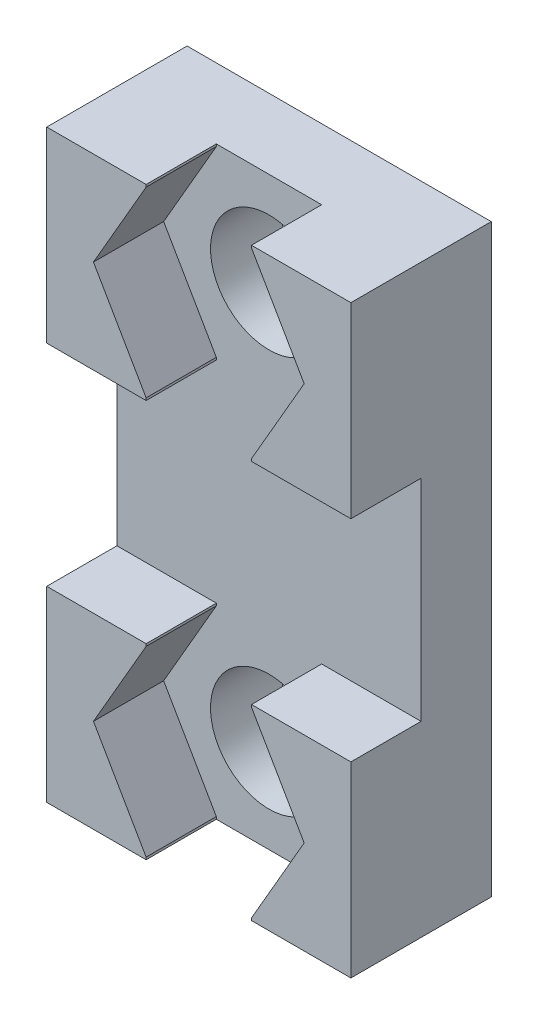
from build123d import *

# Parameters (mm, degrees)
SKETCH1_W           = 6.5
SKETCH1_H           = 12.5
SKETCH1_R           = 1.25
BOSS_EXTRUDE1_DEPTH = 1.5
BOSS_EXTRUDE2_DEPTH = 1.5


with BuildPart() as part:
    # Sketch1 → Boss-Extrude1 (new body)
    with BuildSketch(Plane.XY):
        with Locations((-44.25, -9.275)):
            Rectangle(SKETCH1_W, SKETCH1_H)
        with Locations((-44.25, -5.025)):
            Circle(SKETCH1_R, mode=Mode.SUBTRACT)
        with Locations((-44.25, -13.525)):
            Circle(SKETCH1_R, mode=Mode.SUBTRACT)
    extrude(amount=BOSS_EXTRUDE1_DEPTH)

    # Sketch2 → Boss-Extrude2 (add)
    with BuildSketch(Plane.XY.offset(1.5)):
        Polygon((-45.375833025, -11.575), (-45.375833025, -11.525), (-47.5, -11.525), (-47.5, -15.525), (-45.375833025, -15.525), (-45.375833025, -15.475), (-46.50166605, -13.525), align=None)
        Polygon((-41, -11.525), (-43.124166975, -11.525), (-43.124166975, -11.575), (-41.99833395, -13.525), (-43.124166975, -15.475), (-43.124166975, -15.525), (-41, -15.525), align=None)
        Polygon((-47.5, -3.025), (-47.5, -7.025), (-45.375833025, -7.025), (-45.375833025, -6.975), (-46.50166605, -5.025), (-45.375833025, -3.075), (-45.375833025, -3.025), align=None)
        Polygon((-43.124166975, -7.025), (-41, -7.025), (-41, -3.025), (-43.124166975, -3.025), (-43.124166975, -3.075), (-41.99833395, -5.025), (-43.124166975, -6.975), align=None)
    extrude(amount=BOSS_EXTRUDE2_DEPTH)


solid = part.part
